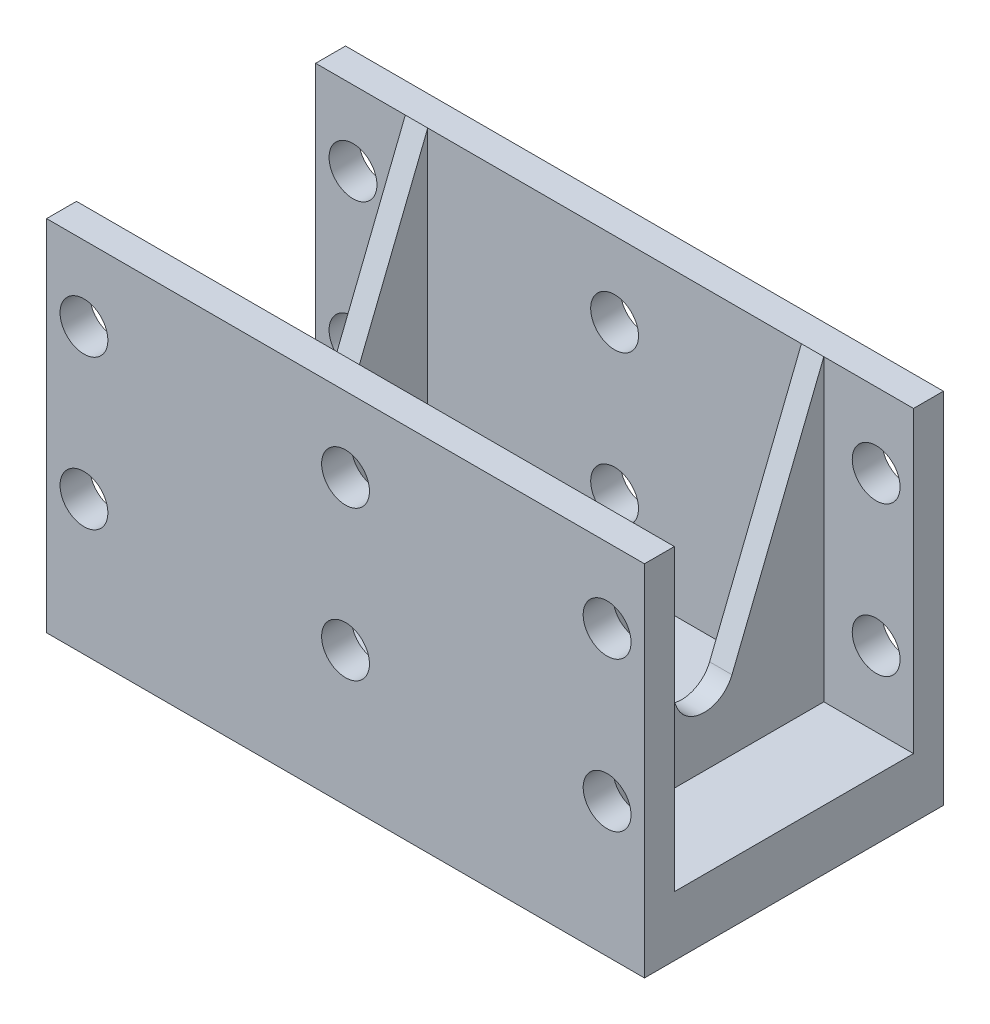
from build123d import *

# Parameters (mm, degrees)
SKETCH1_W            = 25
SKETCH1_H            = 9.6
BOSS_EXTRUDE1_DEPTH  = 2
SKETCH3_R            = 2.3
CUT_EXTRUDE1_DEPTH   = 14.538463724
SKETCH4_W            = 20.2
SKETCH4_H            = 6.2
CUT_EXTRUDE2_DEPTH   = 0.27
SKETCH5_W            = 40
SKETCH5_H            = 20
BOSS_EXTRUDE2_DEPTH  = 4
M3_CLEARANCE_HOLE1_D = 3.2
SKETCH9_W            = 40
SKETCH9_H            = 2
BOSS_EXTRUDE4_DEPTH  = 20
BOSS_EXTRUDE5_DEPTH  = 1.5
FILLET1_R            = 2
FILLET1_OF_MIRROR1_R = 2
M3_CLEARANCE_HOLE2_D = 3.2


with BuildPart() as part:
    # Sketch1 → Boss-Extrude1 (new body)
    with BuildSketch(Plane(origin=(0, 0, 0), x_dir=(1, 0, 0), z_dir=(0, 1, 0))):
        Rectangle(SKETCH1_W, SKETCH1_H)
    extrude(amount=BOSS_EXTRUDE1_DEPTH)

    # Sketch3 → Cut-Extrude1 (cut, through all)
    with BuildSketch(Plane(origin=(0, 2, 0), x_dir=(1, 0, 0), z_dir=(0, 1, 0))):
        with Locations(Location((-7, 0, 0), (0, 0, 270))):
            Circle(SKETCH3_R)
        with Locations(Location((7, 0, 0), (0, 0, 270))):
            Circle(SKETCH3_R)
    extrude(amount=-CUT_EXTRUDE1_DEPTH, mode=Mode.SUBTRACT)

    # Sketch4 → Cut-Extrude2 (cut)
    with BuildSketch(Plane(origin=(0, 0, 0), x_dir=(1, 0, 0), z_dir=(0, 1, 0))):
        Rectangle(SKETCH4_W, SKETCH4_H)
    extrude(amount=CUT_EXTRUDE2_DEPTH, mode=Mode.SUBTRACT)

    # Sketch5 → Boss-Extrude2 (add)
    with BuildSketch(Plane(origin=(0, 2, 0), x_dir=(1, 0, 0), z_dir=(0, 1, 0))):
        Rectangle(SKETCH5_W, SKETCH5_H)
    extrude(amount=BOSS_EXTRUDE2_DEPTH)

    # M3 Clearance Hole1 (through all)
    with Locations(Plane(origin=(0, 2, 0), x_dir=(-1, 0, 0), z_dir=(0, -1, 0))):
        with Locations((-7, 0), (7, 0)):
            Hole(M3_CLEARANCE_HOLE1_D / 2)

    # Sketch9 → Boss-Extrude4 (add)
    with BuildSketch(Plane(origin=(0, 6, 0), x_dir=(1, 0, 0), z_dir=(0, 1, 0))):
        with Locations((0, 9)):
            Rectangle(SKETCH9_W, SKETCH9_H)
        with Locations((0, -9)):
            Rectangle(SKETCH9_W, SKETCH9_H)
    extrude(amount=BOSS_EXTRUDE4_DEPTH)

    # Sketch10 → Boss-Extrude5 (add)
    with BuildSketch(Plane.ZY.offset(12.5)):
        Polygon((-8, 6), (-8, 26), (0, 6), align=None)
        Polygon((8, 6), (0, 6), (8, 26), align=None)
    boss_extrude5 = extrude(amount=BOSS_EXTRUDE5_DEPTH)

    # Fillet1
    fillet1_edges = [part.edges().sort_by_distance(p)[0] for p in [
        (-13.25, 6, 0),
    ]]
    fillet(fillet1_edges, radius=FILLET1_R)

    # Mirror1: Boss-Extrude5 across plane
    add(boss_extrude5.mirror(Plane.ZY))

    # Fillet1 of Mirror1
    fillet1_of_mirror1_edges = [part.edges().sort_by_distance(p)[0] for p in [
        (13.25, 6, 0),
    ]]
    fillet(fillet1_of_mirror1_edges, radius=FILLET1_OF_MIRROR1_R)

    # M3 Clearance Hole2 (through all)
    with Locations(Plane.XY.offset(10)):
        with Locations((-17.5, 21), (17.5, 21), (17.5, 11), (-17.5, 11), (0, 21), (0, 11)):
            Hole(M3_CLEARANCE_HOLE2_D / 2)


solid = part.part
